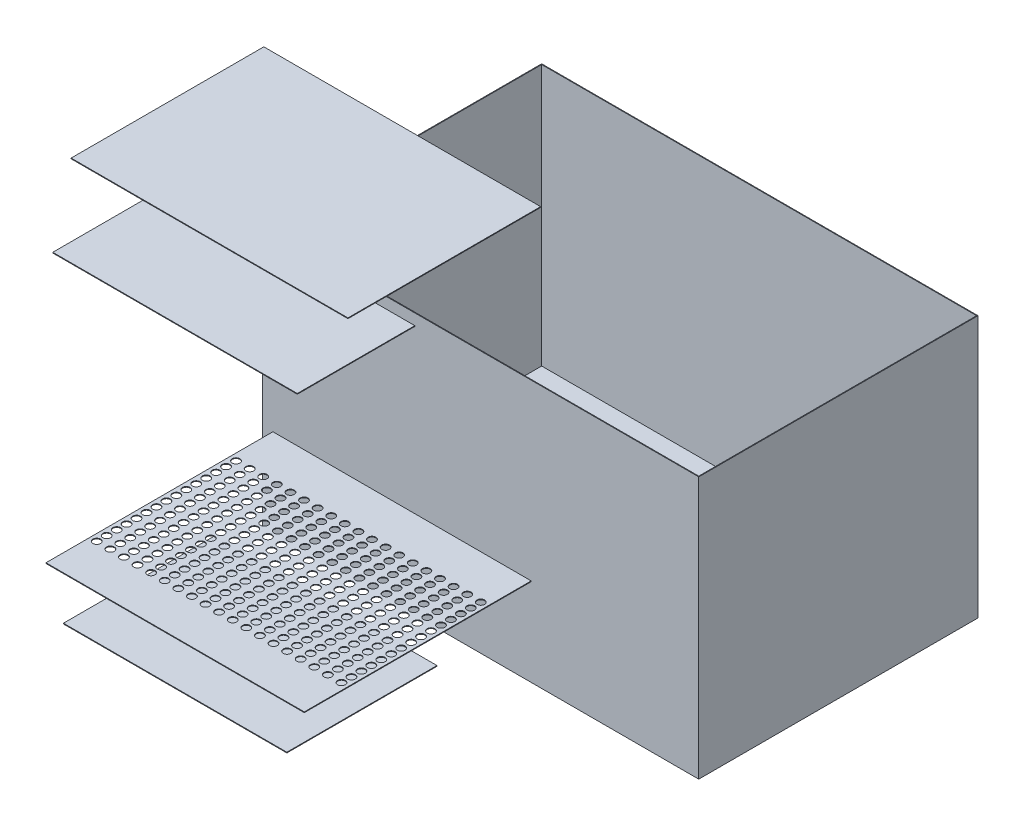
from build123d import *

# Parameters (mm, degrees)
MASTER_FOOTPRINT_W            = 1250
MASTER_FOOTPRINT_H            = 800
BATH_BASE_PLATE_DEPTH         = 750
BATH_SHELL_2MM_T              = -2
INLET_IMPACT_BAFFLE_START     = 125
SKETCH_1_W                    = 640
SKETCH_1_H                    = 430
INLET_IMPACT_BAFFLE_DEPTH     = 2
DISTRIBUTOR_D22_START         = 250
SKETCH_2_W                    = 740
SKETCH_2_H                    = 652
SKETCH_2_R                    = 11
DISTRIBUTOR_D22_DEPTH         = 2
OUTLET_SUBMERGED_BAFFLE_START = 1030
SKETCH_3_W                    = 700.526315789
SKETCH_3_H                    = 336.5
OUTLET_SUBMERGED_BAFFLE_DEPTH = 2
OVERFLOW_WEIR_Z550_START      = 1190
SKETCH_4_W                    = 793
SKETCH_4_H                    = 552
OVERFLOW_WEIR_Z550_DEPTH      = 2


with BuildPart() as part:
    # MASTER_FOOTPRINT → BATH_BASE_PLATE (new body)
    with BuildSketch(Plane(origin=(0, 0, 0), x_dir=(1, 0, 0), z_dir=(0, 1, 0))):
        with Locations((625, 400)):
            Rectangle(MASTER_FOOTPRINT_W, MASTER_FOOTPRINT_H)
    extrude(amount=BATH_BASE_PLATE_DEPTH)

    # BATH_SHELL_2MM
    bath_shell_2mm_openings = [part.faces().sort_by_distance(p)[0] for p in [
        (625, 750, -400),
    ]]
    offset(amount=BATH_SHELL_2MM_T, openings=bath_shell_2mm_openings, kind=Kind.INTERSECTION)


with BuildPart() as body_2:
    # Эскиз1 → INLET_IMPACT_BAFFLE (new body)
    with BuildSketch(Plane(origin=(0, 0, 0), x_dir=(1, 0, 0), z_dir=(0, 1, 0)).offset(INLET_IMPACT_BAFFLE_START)):
        with Locations((400, -435)):
            Rectangle(SKETCH_1_W, SKETCH_1_H)
    extrude(amount=INLET_IMPACT_BAFFLE_DEPTH)


with BuildPart() as body_3:
    # Эскиз2 → DISTRIBUTOR_D22 (new body)
    with BuildSketch(Plane(origin=(0, 0, 0), x_dir=(1, 0, 0), z_dir=(0, 1, 0)).offset(DISTRIBUTOR_D22_START)):
        with Locations((400, -324)):
            Rectangle(SKETCH_2_W, SKETCH_2_H)
        with Locations(Location((49.473684211, -125, 0), (0, 0, 270))):
            Circle(SKETCH_2_R, mode=Mode.SUBTRACT)
        with Locations(Location((49.473684211, -153.5, 0), (0, 0, 270))):
            Circle(SKETCH_2_R, mode=Mode.SUBTRACT)
        with Locations(Location((49.473684211, -182, 0), (0, 0, 270))):
            Circle(SKETCH_2_R, mode=Mode.SUBTRACT)
        with Locations(Location((49.473684211, -210.5, 0), (0, 0, 270))):
            Circle(SKETCH_2_R, mode=Mode.SUBTRACT)
        with Locations(Location((49.473684211, -239, 0), (0, 0, 270))):
            Circle(SKETCH_2_R, mode=Mode.SUBTRACT)
        with Locations(Location((49.473684211, -267.5, 0), (0, 0, 270))):
            Circle(SKETCH_2_R, mode=Mode.SUBTRACT)
        with Locations(Location((49.473684211, -296, 0), (0, 0, 270))):
            Circle(SKETCH_2_R, mode=Mode.SUBTRACT)
        with Locations(Location((49.473684211, -324.5, 0), (0, 0, 270))):
            Circle(SKETCH_2_R, mode=Mode.SUBTRACT)
        with Locations(Location((49.473684211, -353, 0), (0, 0, 270))):
            Circle(SKETCH_2_R, mode=Mode.SUBTRACT)
        with Locations(Location((49.473684211, -381.5, 0), (0, 0, 270))):
            Circle(SKETCH_2_R, mode=Mode.SUBTRACT)
        with Locations(Location((49.473684211, -410, 0), (0, 0, 270))):
            Circle(SKETCH_2_R, mode=Mode.SUBTRACT)
        with Locations(Location((49.473684211, -438.5, 0), (0, 0, 270))):
            Circle(SKETCH_2_R, mode=Mode.SUBTRACT)
        with Locations(Location((49.473684211, -467, 0), (0, 0, 270))):
            Circle(SKETCH_2_R, mode=Mode.SUBTRACT)
        with Locations(Location((49.473684211, -495.5, 0), (0, 0, 270))):
            Circle(SKETCH_2_R, mode=Mode.SUBTRACT)
        with Locations(Location((49.473684211, -524, 0), (0, 0, 270))):
            Circle(SKETCH_2_R, mode=Mode.SUBTRACT)
        with Locations(Location((88.421052632, -125, 0), (0, 0, 270))):
            Circle(SKETCH_2_R, mode=Mode.SUBTRACT)
        with Locations(Location((88.421052632, -153.5, 0), (0, 0, 270))):
            Circle(SKETCH_2_R, mode=Mode.SUBTRACT)
        with Locations(Location((88.421052632, -182, 0), (0, 0, 270))):
            Circle(SKETCH_2_R, mode=Mode.SUBTRACT)
        with Locations(Location((88.421052632, -210.5, 0), (0, 0, 270))):
            Circle(SKETCH_2_R, mode=Mode.SUBTRACT)
        with Locations(Location((88.421052632, -239, 0), (0, 0, 270))):
            Circle(SKETCH_2_R, mode=Mode.SUBTRACT)
        with Locations(Location((88.421052632, -267.5, 0), (0, 0, 270))):
            Circle(SKETCH_2_R, mode=Mode.SUBTRACT)
        with Locations(Location((88.421052632, -296, 0), (0, 0, 270))):
            Circle(SKETCH_2_R, mode=Mode.SUBTRACT)
        with Locations(Location((88.421052632, -324.5, 0), (0, 0, 270))):
            Circle(SKETCH_2_R, mode=Mode.SUBTRACT)
        with Locations(Location((88.421052632, -353, 0), (0, 0, 270))):
            Circle(SKETCH_2_R, mode=Mode.SUBTRACT)
        with Locations(Location((88.421052632, -381.5, 0), (0, 0, 270))):
            Circle(SKETCH_2_R, mode=Mode.SUBTRACT)
        with Locations(Location((88.421052632, -410, 0), (0, 0, 270))):
            Circle(SKETCH_2_R, mode=Mode.SUBTRACT)
        with Locations(Location((88.421052632, -438.5, 0), (0, 0, 270))):
            Circle(SKETCH_2_R, mode=Mode.SUBTRACT)
        with Locations(Location((88.421052632, -467, 0), (0, 0, 270))):
            Circle(SKETCH_2_R, mode=Mode.SUBTRACT)
        with Locations(Location((88.421052632, -495.5, 0), (0, 0, 270))):
            Circle(SKETCH_2_R, mode=Mode.SUBTRACT)
        with Locations(Location((88.421052632, -524, 0), (0, 0, 270))):
            Circle(SKETCH_2_R, mode=Mode.SUBTRACT)
        with Locations(Location((127.368421053, -125, 0), (0, 0, 270))):
            Circle(SKETCH_2_R, mode=Mode.SUBTRACT)
        with Locations(Location((127.368421053, -153.5, 0), (0, 0, 270))):
            Circle(SKETCH_2_R, mode=Mode.SUBTRACT)
        with Locations(Location((127.368421053, -182, 0), (0, 0, 270))):
            Circle(SKETCH_2_R, mode=Mode.SUBTRACT)
        with Locations(Location((127.368421053, -210.5, 0), (0, 0, 270))):
            Circle(SKETCH_2_R, mode=Mode.SUBTRACT)
        with Locations(Location((127.368421053, -239, 0), (0, 0, 270))):
            Circle(SKETCH_2_R, mode=Mode.SUBTRACT)
        with Locations(Location((127.368421053, -267.5, 0), (0, 0, 270))):
            Circle(SKETCH_2_R, mode=Mode.SUBTRACT)
        with Locations(Location((127.368421053, -296, 0), (0, 0, 270))):
            Circle(SKETCH_2_R, mode=Mode.SUBTRACT)
        with Locations(Location((127.368421053, -324.5, 0), (0, 0, 270))):
            Circle(SKETCH_2_R, mode=Mode.SUBTRACT)
        with Locations(Location((127.368421053, -353, 0), (0, 0, 270))):
            Circle(SKETCH_2_R, mode=Mode.SUBTRACT)
        with Locations(Location((127.368421053, -381.5, 0), (0, 0, 270))):
            Circle(SKETCH_2_R, mode=Mode.SUBTRACT)
        with Locations(Location((127.368421053, -410, 0), (0, 0, 270))):
            Circle(SKETCH_2_R, mode=Mode.SUBTRACT)
        with Locations(Location((127.368421053, -438.5, 0), (0, 0, 270))):
            Circle(SKETCH_2_R, mode=Mode.SUBTRACT)
        with Locations(Location((127.368421053, -467, 0), (0, 0, 270))):
            Circle(SKETCH_2_R, mode=Mode.SUBTRACT)
        with Locations(Location((127.368421053, -495.5, 0), (0, 0, 270))):
            Circle(SKETCH_2_R, mode=Mode.SUBTRACT)
        with Locations(Location((127.368421053, -524, 0), (0, 0, 270))):
            Circle(SKETCH_2_R, mode=Mode.SUBTRACT)
        with Locations(Location((166.315789474, -125, 0), (0, 0, 270))):
            Circle(SKETCH_2_R, mode=Mode.SUBTRACT)
        with Locations(Location((166.315789474, -153.5, 0), (0, 0, 270))):
            Circle(SKETCH_2_R, mode=Mode.SUBTRACT)
        with Locations(Location((166.315789474, -182, 0), (0, 0, 270))):
            Circle(SKETCH_2_R, mode=Mode.SUBTRACT)
        with Locations(Location((166.315789474, -210.5, 0), (0, 0, 270))):
            Circle(SKETCH_2_R, mode=Mode.SUBTRACT)
        with Locations(Location((166.315789474, -239, 0), (0, 0, 270))):
            Circle(SKETCH_2_R, mode=Mode.SUBTRACT)
        with Locations(Location((166.315789474, -267.5, 0), (0, 0, 270))):
            Circle(SKETCH_2_R, mode=Mode.SUBTRACT)
        with Locations(Location((166.315789474, -296, 0), (0, 0, 270))):
            Circle(SKETCH_2_R, mode=Mode.SUBTRACT)
        with Locations(Location((166.315789474, -324.5, 0), (0, 0, 270))):
            Circle(SKETCH_2_R, mode=Mode.SUBTRACT)
        with Locations(Location((166.315789474, -353, 0), (0, 0, 270))):
            Circle(SKETCH_2_R, mode=Mode.SUBTRACT)
        with Locations(Location((166.315789474, -381.5, 0), (0, 0, 270))):
            Circle(SKETCH_2_R, mode=Mode.SUBTRACT)
        with Locations(Location((166.315789474, -410, 0), (0, 0, 270))):
            Circle(SKETCH_2_R, mode=Mode.SUBTRACT)
        with Locations(Location((166.315789474, -438.5, 0), (0, 0, 270))):
            Circle(SKETCH_2_R, mode=Mode.SUBTRACT)
        with Locations(Location((166.315789474, -467, 0), (0, 0, 270))):
            Circle(SKETCH_2_R, mode=Mode.SUBTRACT)
        with Locations(Location((166.315789474, -495.5, 0), (0, 0, 270))):
            Circle(SKETCH_2_R, mode=Mode.SUBTRACT)
        with Locations(Location((166.315789474, -524, 0), (0, 0, 270))):
            Circle(SKETCH_2_R, mode=Mode.SUBTRACT)
        with Locations(Location((205.263157895, -125, 0), (0, 0, 270))):
            Circle(SKETCH_2_R, mode=Mode.SUBTRACT)
        with Locations(Location((205.263157895, -153.5, 0), (0, 0, 270))):
            Circle(SKETCH_2_R, mode=Mode.SUBTRACT)
        with Locations(Location((205.263157895, -182, 0), (0, 0, 270))):
            Circle(SKETCH_2_R, mode=Mode.SUBTRACT)
        with Locations(Location((205.263157895, -210.5, 0), (0, 0, 270))):
            Circle(SKETCH_2_R, mode=Mode.SUBTRACT)
        with Locations(Location((205.263157895, -239, 0), (0, 0, 270))):
            Circle(SKETCH_2_R, mode=Mode.SUBTRACT)
        with Locations(Location((205.263157895, -267.5, 0), (0, 0, 270))):
            Circle(SKETCH_2_R, mode=Mode.SUBTRACT)
        with Locations(Location((205.263157895, -296, 0), (0, 0, 270))):
            Circle(SKETCH_2_R, mode=Mode.SUBTRACT)
        with Locations(Location((205.263157895, -324.5, 0), (0, 0, 270))):
            Circle(SKETCH_2_R, mode=Mode.SUBTRACT)
        with Locations(Location((205.263157895, -353, 0), (0, 0, 270))):
            Circle(SKETCH_2_R, mode=Mode.SUBTRACT)
        with Locations(Location((205.263157895, -381.5, 0), (0, 0, 270))):
            Circle(SKETCH_2_R, mode=Mode.SUBTRACT)
        with Locations(Location((205.263157895, -410, 0), (0, 0, 270))):
            Circle(SKETCH_2_R, mode=Mode.SUBTRACT)
        with Locations(Location((205.263157895, -438.5, 0), (0, 0, 270))):
            Circle(SKETCH_2_R, mode=Mode.SUBTRACT)
        with Locations(Location((205.263157895, -467, 0), (0, 0, 270))):
            Circle(SKETCH_2_R, mode=Mode.SUBTRACT)
        with Locations(Location((205.263157895, -495.5, 0), (0, 0, 270))):
            Circle(SKETCH_2_R, mode=Mode.SUBTRACT)
        with Locations(Location((205.263157895, -524, 0), (0, 0, 270))):
            Circle(SKETCH_2_R, mode=Mode.SUBTRACT)
        with Locations(Location((244.210526316, -125, 0), (0, 0, 270))):
            Circle(SKETCH_2_R, mode=Mode.SUBTRACT)
        with Locations(Location((244.210526316, -153.5, 0), (0, 0, 270))):
            Circle(SKETCH_2_R, mode=Mode.SUBTRACT)
        with Locations(Location((244.210526316, -182, 0), (0, 0, 270))):
            Circle(SKETCH_2_R, mode=Mode.SUBTRACT)
        with Locations(Location((244.210526316, -210.5, 0), (0, 0, 270))):
            Circle(SKETCH_2_R, mode=Mode.SUBTRACT)
        with Locations(Location((244.210526316, -239, 0), (0, 0, 270))):
            Circle(SKETCH_2_R, mode=Mode.SUBTRACT)
        with Locations(Location((244.210526316, -267.5, 0), (0, 0, 270))):
            Circle(SKETCH_2_R, mode=Mode.SUBTRACT)
        with Locations(Location((244.210526316, -296, 0), (0, 0, 270))):
            Circle(SKETCH_2_R, mode=Mode.SUBTRACT)
        with Locations(Location((244.210526316, -324.5, 0), (0, 0, 270))):
            Circle(SKETCH_2_R, mode=Mode.SUBTRACT)
        with Locations(Location((244.210526316, -353, 0), (0, 0, 270))):
            Circle(SKETCH_2_R, mode=Mode.SUBTRACT)
        with Locations(Location((244.210526316, -381.5, 0), (0, 0, 270))):
            Circle(SKETCH_2_R, mode=Mode.SUBTRACT)
        with Locations(Location((244.210526316, -410, 0), (0, 0, 270))):
            Circle(SKETCH_2_R, mode=Mode.SUBTRACT)
        with Locations(Location((244.210526316, -438.5, 0), (0, 0, 270))):
            Circle(SKETCH_2_R, mode=Mode.SUBTRACT)
        with Locations(Location((244.210526316, -467, 0), (0, 0, 270))):
            Circle(SKETCH_2_R, mode=Mode.SUBTRACT)
        with Locations(Location((244.210526316, -495.5, 0), (0, 0, 270))):
            Circle(SKETCH_2_R, mode=Mode.SUBTRACT)
        with Locations(Location((244.210526316, -524, 0), (0, 0, 270))):
            Circle(SKETCH_2_R, mode=Mode.SUBTRACT)
        with Locations(Location((283.157894737, -125, 0), (0, 0, 270))):
            Circle(SKETCH_2_R, mode=Mode.SUBTRACT)
        with Locations(Location((283.157894737, -153.5, 0), (0, 0, 270))):
            Circle(SKETCH_2_R, mode=Mode.SUBTRACT)
        with Locations(Location((283.157894737, -182, 0), (0, 0, 270))):
            Circle(SKETCH_2_R, mode=Mode.SUBTRACT)
        with Locations(Location((283.157894737, -210.5, 0), (0, 0, 270))):
            Circle(SKETCH_2_R, mode=Mode.SUBTRACT)
        with Locations(Location((283.157894737, -239, 0), (0, 0, 270))):
            Circle(SKETCH_2_R, mode=Mode.SUBTRACT)
        with Locations(Location((283.157894737, -267.5, 0), (0, 0, 270))):
            Circle(SKETCH_2_R, mode=Mode.SUBTRACT)
        with Locations(Location((283.157894737, -296, 0), (0, 0, 270))):
            Circle(SKETCH_2_R, mode=Mode.SUBTRACT)
        with Locations(Location((283.157894737, -324.5, 0), (0, 0, 270))):
            Circle(SKETCH_2_R, mode=Mode.SUBTRACT)
        with Locations(Location((283.157894737, -353, 0), (0, 0, 270))):
            Circle(SKETCH_2_R, mode=Mode.SUBTRACT)
        with Locations(Location((283.157894737, -381.5, 0), (0, 0, 270))):
            Circle(SKETCH_2_R, mode=Mode.SUBTRACT)
        with Locations(Location((283.157894737, -410, 0), (0, 0, 270))):
            Circle(SKETCH_2_R, mode=Mode.SUBTRACT)
        with Locations(Location((283.157894737, -438.5, 0), (0, 0, 270))):
            Circle(SKETCH_2_R, mode=Mode.SUBTRACT)
        with Locations(Location((283.157894737, -467, 0), (0, 0, 270))):
            Circle(SKETCH_2_R, mode=Mode.SUBTRACT)
        with Locations(Location((283.157894737, -495.5, 0), (0, 0, 270))):
            Circle(SKETCH_2_R, mode=Mode.SUBTRACT)
        with Locations(Location((283.157894737, -524, 0), (0, 0, 270))):
            Circle(SKETCH_2_R, mode=Mode.SUBTRACT)
        with Locations(Location((322.105263158, -125, 0), (0, 0, 270))):
            Circle(SKETCH_2_R, mode=Mode.SUBTRACT)
        with Locations(Location((322.105263158, -153.5, 0), (0, 0, 270))):
            Circle(SKETCH_2_R, mode=Mode.SUBTRACT)
        with Locations(Location((322.105263158, -182, 0), (0, 0, 270))):
            Circle(SKETCH_2_R, mode=Mode.SUBTRACT)
        with Locations(Location((322.105263158, -210.5, 0), (0, 0, 270))):
            Circle(SKETCH_2_R, mode=Mode.SUBTRACT)
        with Locations(Location((322.105263158, -239, 0), (0, 0, 270))):
            Circle(SKETCH_2_R, mode=Mode.SUBTRACT)
        with Locations(Location((322.105263158, -267.5, 0), (0, 0, 270))):
            Circle(SKETCH_2_R, mode=Mode.SUBTRACT)
        with Locations(Location((322.105263158, -296, 0), (0, 0, 270))):
            Circle(SKETCH_2_R, mode=Mode.SUBTRACT)
        with Locations(Location((322.105263158, -324.5, 0), (0, 0, 270))):
            Circle(SKETCH_2_R, mode=Mode.SUBTRACT)
        with Locations(Location((322.105263158, -353, 0), (0, 0, 270))):
            Circle(SKETCH_2_R, mode=Mode.SUBTRACT)
        with Locations(Location((322.105263158, -381.5, 0), (0, 0, 270))):
            Circle(SKETCH_2_R, mode=Mode.SUBTRACT)
        with Locations(Location((322.105263158, -410, 0), (0, 0, 270))):
            Circle(SKETCH_2_R, mode=Mode.SUBTRACT)
        with Locations(Location((322.105263158, -438.5, 0), (0, 0, 270))):
            Circle(SKETCH_2_R, mode=Mode.SUBTRACT)
        with Locations(Location((322.105263158, -467, 0), (0, 0, 270))):
            Circle(SKETCH_2_R, mode=Mode.SUBTRACT)
        with Locations(Location((322.105263158, -495.5, 0), (0, 0, 270))):
            Circle(SKETCH_2_R, mode=Mode.SUBTRACT)
        with Locations(Location((322.105263158, -524, 0), (0, 0, 270))):
            Circle(SKETCH_2_R, mode=Mode.SUBTRACT)
        with Locations(Location((361.052631579, -125, 0), (0, 0, 270))):
            Circle(SKETCH_2_R, mode=Mode.SUBTRACT)
        with Locations(Location((361.052631579, -153.5, 0), (0, 0, 270))):
            Circle(SKETCH_2_R, mode=Mode.SUBTRACT)
        with Locations(Location((361.052631579, -182, 0), (0, 0, 270))):
            Circle(SKETCH_2_R, mode=Mode.SUBTRACT)
        with Locations(Location((361.052631579, -210.5, 0), (0, 0, 270))):
            Circle(SKETCH_2_R, mode=Mode.SUBTRACT)
        with Locations(Location((361.052631579, -239, 0), (0, 0, 270))):
            Circle(SKETCH_2_R, mode=Mode.SUBTRACT)
        with Locations(Location((361.052631579, -267.5, 0), (0, 0, 270))):
            Circle(SKETCH_2_R, mode=Mode.SUBTRACT)
        with Locations(Location((361.052631579, -296, 0), (0, 0, 270))):
            Circle(SKETCH_2_R, mode=Mode.SUBTRACT)
        with Locations(Location((361.052631579, -324.5, 0), (0, 0, 270))):
            Circle(SKETCH_2_R, mode=Mode.SUBTRACT)
        with Locations(Location((361.052631579, -353, 0), (0, 0, 270))):
            Circle(SKETCH_2_R, mode=Mode.SUBTRACT)
        with Locations(Location((361.052631579, -381.5, 0), (0, 0, 270))):
            Circle(SKETCH_2_R, mode=Mode.SUBTRACT)
        with Locations(Location((361.052631579, -410, 0), (0, 0, 270))):
            Circle(SKETCH_2_R, mode=Mode.SUBTRACT)
        with Locations(Location((361.052631579, -438.5, 0), (0, 0, 270))):
            Circle(SKETCH_2_R, mode=Mode.SUBTRACT)
        with Locations(Location((361.052631579, -467, 0), (0, 0, 270))):
            Circle(SKETCH_2_R, mode=Mode.SUBTRACT)
        with Locations(Location((361.052631579, -495.5, 0), (0, 0, 270))):
            Circle(SKETCH_2_R, mode=Mode.SUBTRACT)
        with Locations(Location((361.052631579, -524, 0), (0, 0, 270))):
            Circle(SKETCH_2_R, mode=Mode.SUBTRACT)
        with Locations(Location((400, -125, 0), (0, 0, 270))):
            Circle(SKETCH_2_R, mode=Mode.SUBTRACT)
        with Locations(Location((400, -153.5, 0), (0, 0, 270))):
            Circle(SKETCH_2_R, mode=Mode.SUBTRACT)
        with Locations(Location((400, -182, 0), (0, 0, 270))):
            Circle(SKETCH_2_R, mode=Mode.SUBTRACT)
        with Locations(Location((400, -210.5, 0), (0, 0, 270))):
            Circle(SKETCH_2_R, mode=Mode.SUBTRACT)
        with Locations(Location((400, -239, 0), (0, 0, 270))):
            Circle(SKETCH_2_R, mode=Mode.SUBTRACT)
        with Locations(Location((400, -267.5, 0), (0, 0, 270))):
            Circle(SKETCH_2_R, mode=Mode.SUBTRACT)
        with Locations(Location((400, -296, 0), (0, 0, 270))):
            Circle(SKETCH_2_R, mode=Mode.SUBTRACT)
        with Locations(Location((400, -324.5, 0), (0, 0, 270))):
            Circle(SKETCH_2_R, mode=Mode.SUBTRACT)
        with Locations(Location((400, -353, 0), (0, 0, 270))):
            Circle(SKETCH_2_R, mode=Mode.SUBTRACT)
        with Locations(Location((400, -381.5, 0), (0, 0, 270))):
            Circle(SKETCH_2_R, mode=Mode.SUBTRACT)
        with Locations(Location((400, -410, 0), (0, 0, 270))):
            Circle(SKETCH_2_R, mode=Mode.SUBTRACT)
        with Locations(Location((400, -438.5, 0), (0, 0, 270))):
            Circle(SKETCH_2_R, mode=Mode.SUBTRACT)
        with Locations(Location((400, -467, 0), (0, 0, 270))):
            Circle(SKETCH_2_R, mode=Mode.SUBTRACT)
        with Locations(Location((400, -495.5, 0), (0, 0, 270))):
            Circle(SKETCH_2_R, mode=Mode.SUBTRACT)
        with Locations(Location((400, -524, 0), (0, 0, 270))):
            Circle(SKETCH_2_R, mode=Mode.SUBTRACT)
        with Locations(Location((438.947368421, -125, 0), (0, 0, 270))):
            Circle(SKETCH_2_R, mode=Mode.SUBTRACT)
        with Locations(Location((438.947368421, -153.5, 0), (0, 0, 270))):
            Circle(SKETCH_2_R, mode=Mode.SUBTRACT)
        with Locations(Location((438.947368421, -182, 0), (0, 0, 270))):
            Circle(SKETCH_2_R, mode=Mode.SUBTRACT)
        with Locations(Location((438.947368421, -210.5, 0), (0, 0, 270))):
            Circle(SKETCH_2_R, mode=Mode.SUBTRACT)
        with Locations(Location((438.947368421, -239, 0), (0, 0, 270))):
            Circle(SKETCH_2_R, mode=Mode.SUBTRACT)
        with Locations(Location((438.947368421, -267.5, 0), (0, 0, 270))):
            Circle(SKETCH_2_R, mode=Mode.SUBTRACT)
        with Locations(Location((438.947368421, -296, 0), (0, 0, 270))):
            Circle(SKETCH_2_R, mode=Mode.SUBTRACT)
        with Locations(Location((438.947368421, -324.5, 0), (0, 0, 270))):
            Circle(SKETCH_2_R, mode=Mode.SUBTRACT)
        with Locations(Location((438.947368421, -353, 0), (0, 0, 270))):
            Circle(SKETCH_2_R, mode=Mode.SUBTRACT)
        with Locations(Location((438.947368421, -381.5, 0), (0, 0, 270))):
            Circle(SKETCH_2_R, mode=Mode.SUBTRACT)
        with Locations(Location((438.947368421, -410, 0), (0, 0, 270))):
            Circle(SKETCH_2_R, mode=Mode.SUBTRACT)
        with Locations(Location((438.947368421, -438.5, 0), (0, 0, 270))):
            Circle(SKETCH_2_R, mode=Mode.SUBTRACT)
        with Locations(Location((438.947368421, -467, 0), (0, 0, 270))):
            Circle(SKETCH_2_R, mode=Mode.SUBTRACT)
        with Locations(Location((438.947368421, -495.5, 0), (0, 0, 270))):
            Circle(SKETCH_2_R, mode=Mode.SUBTRACT)
        with Locations(Location((438.947368421, -524, 0), (0, 0, 270))):
            Circle(SKETCH_2_R, mode=Mode.SUBTRACT)
        with Locations(Location((477.894736842, -125, 0), (0, 0, 270))):
            Circle(SKETCH_2_R, mode=Mode.SUBTRACT)
        with Locations(Location((477.894736842, -153.5, 0), (0, 0, 270))):
            Circle(SKETCH_2_R, mode=Mode.SUBTRACT)
        with Locations(Location((477.894736842, -182, 0), (0, 0, 270))):
            Circle(SKETCH_2_R, mode=Mode.SUBTRACT)
        with Locations(Location((477.894736842, -210.5, 0), (0, 0, 270))):
            Circle(SKETCH_2_R, mode=Mode.SUBTRACT)
        with Locations(Location((477.894736842, -239, 0), (0, 0, 270))):
            Circle(SKETCH_2_R, mode=Mode.SUBTRACT)
        with Locations(Location((477.894736842, -267.5, 0), (0, 0, 270))):
            Circle(SKETCH_2_R, mode=Mode.SUBTRACT)
        with Locations(Location((477.894736842, -296, 0), (0, 0, 270))):
            Circle(SKETCH_2_R, mode=Mode.SUBTRACT)
        with Locations(Location((477.894736842, -324.5, 0), (0, 0, 270))):
            Circle(SKETCH_2_R, mode=Mode.SUBTRACT)
        with Locations(Location((477.894736842, -353, 0), (0, 0, 270))):
            Circle(SKETCH_2_R, mode=Mode.SUBTRACT)
        with Locations(Location((477.894736842, -381.5, 0), (0, 0, 270))):
            Circle(SKETCH_2_R, mode=Mode.SUBTRACT)
        with Locations(Location((477.894736842, -410, 0), (0, 0, 270))):
            Circle(SKETCH_2_R, mode=Mode.SUBTRACT)
        with Locations(Location((477.894736842, -438.5, 0), (0, 0, 270))):
            Circle(SKETCH_2_R, mode=Mode.SUBTRACT)
        with Locations(Location((477.894736842, -467, 0), (0, 0, 270))):
            Circle(SKETCH_2_R, mode=Mode.SUBTRACT)
        with Locations(Location((477.894736842, -495.5, 0), (0, 0, 270))):
            Circle(SKETCH_2_R, mode=Mode.SUBTRACT)
        with Locations(Location((477.894736842, -524, 0), (0, 0, 270))):
            Circle(SKETCH_2_R, mode=Mode.SUBTRACT)
        with Locations(Location((516.842105263, -125, 0), (0, 0, 270))):
            Circle(SKETCH_2_R, mode=Mode.SUBTRACT)
        with Locations(Location((516.842105263, -153.5, 0), (0, 0, 270))):
            Circle(SKETCH_2_R, mode=Mode.SUBTRACT)
        with Locations(Location((516.842105263, -182, 0), (0, 0, 270))):
            Circle(SKETCH_2_R, mode=Mode.SUBTRACT)
        with Locations(Location((516.842105263, -210.5, 0), (0, 0, 270))):
            Circle(SKETCH_2_R, mode=Mode.SUBTRACT)
        with Locations(Location((516.842105263, -239, 0), (0, 0, 270))):
            Circle(SKETCH_2_R, mode=Mode.SUBTRACT)
        with Locations(Location((516.842105263, -267.5, 0), (0, 0, 270))):
            Circle(SKETCH_2_R, mode=Mode.SUBTRACT)
        with Locations(Location((516.842105263, -296, 0), (0, 0, 270))):
            Circle(SKETCH_2_R, mode=Mode.SUBTRACT)
        with Locations(Location((516.842105263, -324.5, 0), (0, 0, 270))):
            Circle(SKETCH_2_R, mode=Mode.SUBTRACT)
        with Locations(Location((516.842105263, -353, 0), (0, 0, 270))):
            Circle(SKETCH_2_R, mode=Mode.SUBTRACT)
        with Locations(Location((516.842105263, -381.5, 0), (0, 0, 270))):
            Circle(SKETCH_2_R, mode=Mode.SUBTRACT)
        with Locations(Location((516.842105263, -410, 0), (0, 0, 270))):
            Circle(SKETCH_2_R, mode=Mode.SUBTRACT)
        with Locations(Location((516.842105263, -438.5, 0), (0, 0, 270))):
            Circle(SKETCH_2_R, mode=Mode.SUBTRACT)
        with Locations(Location((516.842105263, -467, 0), (0, 0, 270))):
            Circle(SKETCH_2_R, mode=Mode.SUBTRACT)
        with Locations(Location((516.842105263, -495.5, 0), (0, 0, 270))):
            Circle(SKETCH_2_R, mode=Mode.SUBTRACT)
        with Locations(Location((516.842105263, -524, 0), (0, 0, 270))):
            Circle(SKETCH_2_R, mode=Mode.SUBTRACT)
        with Locations(Location((555.789473684, -125, 0), (0, 0, 270))):
            Circle(SKETCH_2_R, mode=Mode.SUBTRACT)
        with Locations(Location((555.789473684, -153.5, 0), (0, 0, 270))):
            Circle(SKETCH_2_R, mode=Mode.SUBTRACT)
        with Locations(Location((555.789473684, -182, 0), (0, 0, 270))):
            Circle(SKETCH_2_R, mode=Mode.SUBTRACT)
        with Locations(Location((555.789473684, -210.5, 0), (0, 0, 270))):
            Circle(SKETCH_2_R, mode=Mode.SUBTRACT)
        with Locations(Location((555.789473684, -239, 0), (0, 0, 270))):
            Circle(SKETCH_2_R, mode=Mode.SUBTRACT)
        with Locations(Location((555.789473684, -267.5, 0), (0, 0, 270))):
            Circle(SKETCH_2_R, mode=Mode.SUBTRACT)
        with Locations(Location((555.789473684, -296, 0), (0, 0, 270))):
            Circle(SKETCH_2_R, mode=Mode.SUBTRACT)
        with Locations(Location((555.789473684, -324.5, 0), (0, 0, 270))):
            Circle(SKETCH_2_R, mode=Mode.SUBTRACT)
        with Locations(Location((555.789473684, -353, 0), (0, 0, 270))):
            Circle(SKETCH_2_R, mode=Mode.SUBTRACT)
        with Locations(Location((555.789473684, -381.5, 0), (0, 0, 270))):
            Circle(SKETCH_2_R, mode=Mode.SUBTRACT)
        with Locations(Location((555.789473684, -410, 0), (0, 0, 270))):
            Circle(SKETCH_2_R, mode=Mode.SUBTRACT)
        with Locations(Location((555.789473684, -438.5, 0), (0, 0, 270))):
            Circle(SKETCH_2_R, mode=Mode.SUBTRACT)
        with Locations(Location((555.789473684, -467, 0), (0, 0, 270))):
            Circle(SKETCH_2_R, mode=Mode.SUBTRACT)
        with Locations(Location((555.789473684, -495.5, 0), (0, 0, 270))):
            Circle(SKETCH_2_R, mode=Mode.SUBTRACT)
        with Locations(Location((555.789473684, -524, 0), (0, 0, 270))):
            Circle(SKETCH_2_R, mode=Mode.SUBTRACT)
        with Locations(Location((594.736842105, -125, 0), (0, 0, 270))):
            Circle(SKETCH_2_R, mode=Mode.SUBTRACT)
        with Locations(Location((594.736842105, -153.5, 0), (0, 0, 270))):
            Circle(SKETCH_2_R, mode=Mode.SUBTRACT)
        with Locations(Location((594.736842105, -182, 0), (0, 0, 270))):
            Circle(SKETCH_2_R, mode=Mode.SUBTRACT)
        with Locations(Location((594.736842105, -210.5, 0), (0, 0, 270))):
            Circle(SKETCH_2_R, mode=Mode.SUBTRACT)
        with Locations(Location((594.736842105, -239, 0), (0, 0, 270))):
            Circle(SKETCH_2_R, mode=Mode.SUBTRACT)
        with Locations(Location((594.736842105, -267.5, 0), (0, 0, 270))):
            Circle(SKETCH_2_R, mode=Mode.SUBTRACT)
        with Locations(Location((594.736842105, -296, 0), (0, 0, 270))):
            Circle(SKETCH_2_R, mode=Mode.SUBTRACT)
        with Locations(Location((594.736842105, -324.5, 0), (0, 0, 270))):
            Circle(SKETCH_2_R, mode=Mode.SUBTRACT)
        with Locations(Location((594.736842105, -353, 0), (0, 0, 270))):
            Circle(SKETCH_2_R, mode=Mode.SUBTRACT)
        with Locations(Location((594.736842105, -381.5, 0), (0, 0, 270))):
            Circle(SKETCH_2_R, mode=Mode.SUBTRACT)
        with Locations(Location((594.736842105, -410, 0), (0, 0, 270))):
            Circle(SKETCH_2_R, mode=Mode.SUBTRACT)
        with Locations(Location((594.736842105, -438.5, 0), (0, 0, 270))):
            Circle(SKETCH_2_R, mode=Mode.SUBTRACT)
        with Locations(Location((594.736842105, -467, 0), (0, 0, 270))):
            Circle(SKETCH_2_R, mode=Mode.SUBTRACT)
        with Locations(Location((594.736842105, -495.5, 0), (0, 0, 270))):
            Circle(SKETCH_2_R, mode=Mode.SUBTRACT)
        with Locations(Location((594.736842105, -524, 0), (0, 0, 270))):
            Circle(SKETCH_2_R, mode=Mode.SUBTRACT)
        with Locations(Location((633.684210526, -125, 0), (0, 0, 270))):
            Circle(SKETCH_2_R, mode=Mode.SUBTRACT)
        with Locations(Location((633.684210526, -153.5, 0), (0, 0, 270))):
            Circle(SKETCH_2_R, mode=Mode.SUBTRACT)
        with Locations(Location((633.684210526, -182, 0), (0, 0, 270))):
            Circle(SKETCH_2_R, mode=Mode.SUBTRACT)
        with Locations(Location((633.684210526, -210.5, 0), (0, 0, 270))):
            Circle(SKETCH_2_R, mode=Mode.SUBTRACT)
        with Locations(Location((633.684210526, -239, 0), (0, 0, 270))):
            Circle(SKETCH_2_R, mode=Mode.SUBTRACT)
        with Locations(Location((633.684210526, -267.5, 0), (0, 0, 270))):
            Circle(SKETCH_2_R, mode=Mode.SUBTRACT)
        with Locations(Location((633.684210526, -296, 0), (0, 0, 270))):
            Circle(SKETCH_2_R, mode=Mode.SUBTRACT)
        with Locations(Location((633.684210526, -324.5, 0), (0, 0, 270))):
            Circle(SKETCH_2_R, mode=Mode.SUBTRACT)
        with Locations(Location((633.684210526, -353, 0), (0, 0, 270))):
            Circle(SKETCH_2_R, mode=Mode.SUBTRACT)
        with Locations(Location((633.684210526, -381.5, 0), (0, 0, 270))):
            Circle(SKETCH_2_R, mode=Mode.SUBTRACT)
        with Locations(Location((633.684210526, -410, 0), (0, 0, 270))):
            Circle(SKETCH_2_R, mode=Mode.SUBTRACT)
        with Locations(Location((633.684210526, -438.5, 0), (0, 0, 270))):
            Circle(SKETCH_2_R, mode=Mode.SUBTRACT)
        with Locations(Location((633.684210526, -467, 0), (0, 0, 270))):
            Circle(SKETCH_2_R, mode=Mode.SUBTRACT)
        with Locations(Location((633.684210526, -495.5, 0), (0, 0, 270))):
            Circle(SKETCH_2_R, mode=Mode.SUBTRACT)
        with Locations(Location((633.684210526, -524, 0), (0, 0, 270))):
            Circle(SKETCH_2_R, mode=Mode.SUBTRACT)
        with Locations(Location((672.631578947, -125, 0), (0, 0, 270))):
            Circle(SKETCH_2_R, mode=Mode.SUBTRACT)
        with Locations(Location((672.631578947, -153.5, 0), (0, 0, 270))):
            Circle(SKETCH_2_R, mode=Mode.SUBTRACT)
        with Locations(Location((672.631578947, -182, 0), (0, 0, 270))):
            Circle(SKETCH_2_R, mode=Mode.SUBTRACT)
        with Locations(Location((672.631578947, -210.5, 0), (0, 0, 270))):
            Circle(SKETCH_2_R, mode=Mode.SUBTRACT)
        with Locations(Location((672.631578947, -239, 0), (0, 0, 270))):
            Circle(SKETCH_2_R, mode=Mode.SUBTRACT)
        with Locations(Location((672.631578947, -267.5, 0), (0, 0, 270))):
            Circle(SKETCH_2_R, mode=Mode.SUBTRACT)
        with Locations(Location((672.631578947, -296, 0), (0, 0, 270))):
            Circle(SKETCH_2_R, mode=Mode.SUBTRACT)
        with Locations(Location((672.631578947, -324.5, 0), (0, 0, 270))):
            Circle(SKETCH_2_R, mode=Mode.SUBTRACT)
        with Locations(Location((672.631578947, -353, 0), (0, 0, 270))):
            Circle(SKETCH_2_R, mode=Mode.SUBTRACT)
        with Locations(Location((672.631578947, -381.5, 0), (0, 0, 270))):
            Circle(SKETCH_2_R, mode=Mode.SUBTRACT)
        with Locations(Location((672.631578947, -410, 0), (0, 0, 270))):
            Circle(SKETCH_2_R, mode=Mode.SUBTRACT)
        with Locations(Location((672.631578947, -438.5, 0), (0, 0, 270))):
            Circle(SKETCH_2_R, mode=Mode.SUBTRACT)
        with Locations(Location((672.631578947, -467, 0), (0, 0, 270))):
            Circle(SKETCH_2_R, mode=Mode.SUBTRACT)
        with Locations(Location((672.631578947, -495.5, 0), (0, 0, 270))):
            Circle(SKETCH_2_R, mode=Mode.SUBTRACT)
        with Locations(Location((672.631578947, -524, 0), (0, 0, 270))):
            Circle(SKETCH_2_R, mode=Mode.SUBTRACT)
        with Locations(Location((711.578947368, -125, 0), (0, 0, 270))):
            Circle(SKETCH_2_R, mode=Mode.SUBTRACT)
        with Locations(Location((711.578947368, -153.5, 0), (0, 0, 270))):
            Circle(SKETCH_2_R, mode=Mode.SUBTRACT)
        with Locations(Location((711.578947368, -182, 0), (0, 0, 270))):
            Circle(SKETCH_2_R, mode=Mode.SUBTRACT)
        with Locations(Location((711.578947368, -210.5, 0), (0, 0, 270))):
            Circle(SKETCH_2_R, mode=Mode.SUBTRACT)
        with Locations(Location((711.578947368, -239, 0), (0, 0, 270))):
            Circle(SKETCH_2_R, mode=Mode.SUBTRACT)
        with Locations(Location((711.578947368, -267.5, 0), (0, 0, 270))):
            Circle(SKETCH_2_R, mode=Mode.SUBTRACT)
        with Locations(Location((711.578947368, -296, 0), (0, 0, 270))):
            Circle(SKETCH_2_R, mode=Mode.SUBTRACT)
        with Locations(Location((711.578947368, -324.5, 0), (0, 0, 270))):
            Circle(SKETCH_2_R, mode=Mode.SUBTRACT)
        with Locations(Location((711.578947368, -353, 0), (0, 0, 270))):
            Circle(SKETCH_2_R, mode=Mode.SUBTRACT)
        with Locations(Location((711.578947368, -381.5, 0), (0, 0, 270))):
            Circle(SKETCH_2_R, mode=Mode.SUBTRACT)
        with Locations(Location((711.578947368, -410, 0), (0, 0, 270))):
            Circle(SKETCH_2_R, mode=Mode.SUBTRACT)
        with Locations(Location((711.578947368, -438.5, 0), (0, 0, 270))):
            Circle(SKETCH_2_R, mode=Mode.SUBTRACT)
        with Locations(Location((711.578947368, -467, 0), (0, 0, 270))):
            Circle(SKETCH_2_R, mode=Mode.SUBTRACT)
        with Locations(Location((711.578947368, -495.5, 0), (0, 0, 270))):
            Circle(SKETCH_2_R, mode=Mode.SUBTRACT)
        with Locations(Location((711.578947368, -524, 0), (0, 0, 270))):
            Circle(SKETCH_2_R, mode=Mode.SUBTRACT)
        with Locations(Location((750.526315789, -125, 0), (0, 0, 270))):
            Circle(SKETCH_2_R, mode=Mode.SUBTRACT)
        with Locations(Location((750.526315789, -153.5, 0), (0, 0, 270))):
            Circle(SKETCH_2_R, mode=Mode.SUBTRACT)
        with Locations(Location((750.526315789, -182, 0), (0, 0, 270))):
            Circle(SKETCH_2_R, mode=Mode.SUBTRACT)
        with Locations(Location((750.526315789, -210.5, 0), (0, 0, 270))):
            Circle(SKETCH_2_R, mode=Mode.SUBTRACT)
        with Locations(Location((750.526315789, -239, 0), (0, 0, 270))):
            Circle(SKETCH_2_R, mode=Mode.SUBTRACT)
        with Locations(Location((750.526315789, -267.5, 0), (0, 0, 270))):
            Circle(SKETCH_2_R, mode=Mode.SUBTRACT)
        with Locations(Location((750.526315789, -296, 0), (0, 0, 270))):
            Circle(SKETCH_2_R, mode=Mode.SUBTRACT)
        with Locations(Location((750.526315789, -324.5, 0), (0, 0, 270))):
            Circle(SKETCH_2_R, mode=Mode.SUBTRACT)
        with Locations(Location((750.526315789, -353, 0), (0, 0, 270))):
            Circle(SKETCH_2_R, mode=Mode.SUBTRACT)
        with Locations(Location((750.526315789, -381.5, 0), (0, 0, 270))):
            Circle(SKETCH_2_R, mode=Mode.SUBTRACT)
        with Locations(Location((750.526315789, -410, 0), (0, 0, 270))):
            Circle(SKETCH_2_R, mode=Mode.SUBTRACT)
        with Locations(Location((750.526315789, -438.5, 0), (0, 0, 270))):
            Circle(SKETCH_2_R, mode=Mode.SUBTRACT)
        with Locations(Location((750.526315789, -467, 0), (0, 0, 270))):
            Circle(SKETCH_2_R, mode=Mode.SUBTRACT)
        with Locations(Location((750.526315789, -495.5, 0), (0, 0, 270))):
            Circle(SKETCH_2_R, mode=Mode.SUBTRACT)
        with Locations(Location((750.526315789, -524, 0), (0, 0, 270))):
            Circle(SKETCH_2_R, mode=Mode.SUBTRACT)
    extrude(amount=DISTRIBUTOR_D22_DEPTH)


with BuildPart() as body_4:
    # Эскиз3 → OUTLET_SUBMERGED_BAFFLE (new body)
    with BuildSketch(Plane(origin=(0, 0, 0), x_dir=(1, 0, 0), z_dir=(0, 1, 0)).offset(OUTLET_SUBMERGED_BAFFLE_START)):
        with Locations((399.736842105, -481.75)):
            Rectangle(SKETCH_3_W, SKETCH_3_H)
    extrude(amount=OUTLET_SUBMERGED_BAFFLE_DEPTH)


with BuildPart() as body_5:
    # Эскиз4 → OVERFLOW_WEIR_Z550 (new body)
    with BuildSketch(Plane(origin=(0, 0, 0), x_dir=(1, 0, 0), z_dir=(0, 1, 0)).offset(OVERFLOW_WEIR_Z550_START)):
        with Locations((398.5, -274)):
            Rectangle(SKETCH_4_W, SKETCH_4_H)
    extrude(amount=OVERFLOW_WEIR_Z550_DEPTH)


solid = Compound([part.part, body_2.part, body_3.part, body_4.part, body_5.part])
